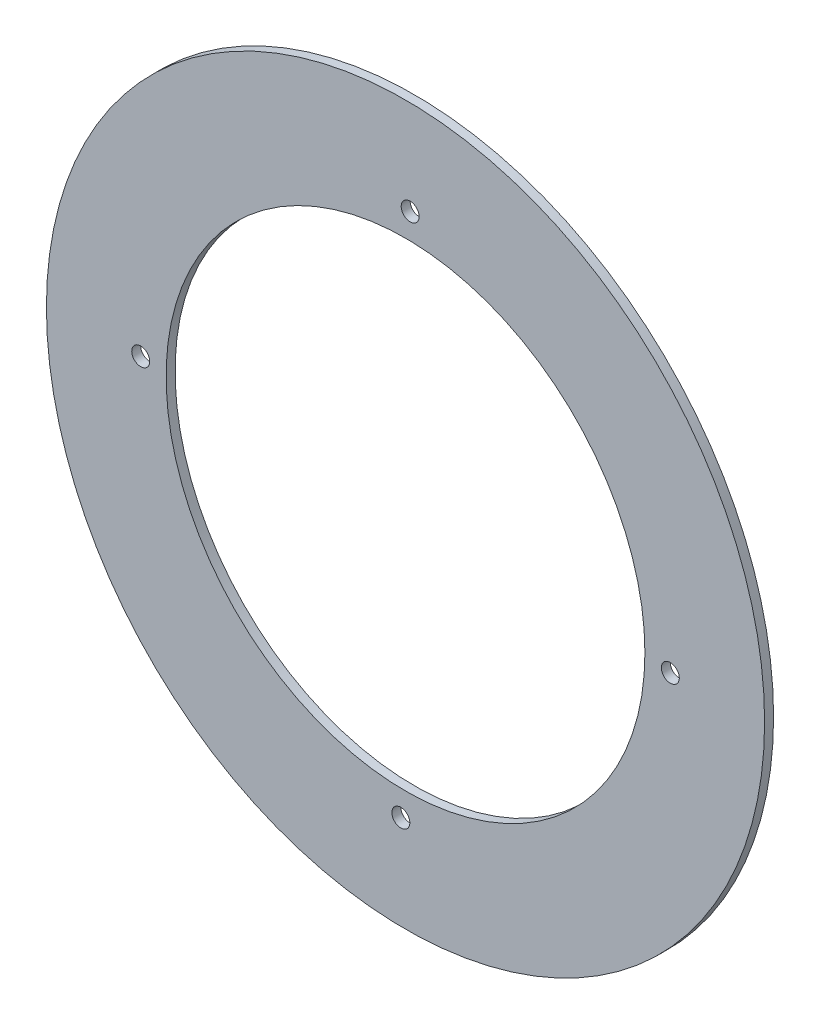
from build123d import *

# Parameters (mm, degrees)
SKETCH_1_R          = 60
SKETCH_1_R_2        = 40
EXTRUDE_1_DEPTH     = 1.5
SKETCH_2_R          = 1.5
CUT_EXTRUDE_2_DEPTH = 2


with BuildPart() as part:
    # 草图1 → 凸台-拉伸1 (new body)
    with BuildSketch(Plane.XY):
        Circle(SKETCH_1_R)
        Circle(SKETCH_1_R_2, mode=Mode.SUBTRACT)
    extrude(amount=EXTRUDE_1_DEPTH)

    # 草图2 → 切除-拉伸2 (cut)
    with BuildSketch(Plane(origin=(0, 0, 0), x_dir=(-1, 0, 0), z_dir=(0, 0, -1))):
        with Locations((-44.243136642, -0.779333123)):
            Circle(SKETCH_2_R)
        with Locations((-0.779333123, 44.243136642)):
            Circle(SKETCH_2_R)
        with Locations((44.243136642, 0.779333123)):
            Circle(SKETCH_2_R)
        with Locations((0.779333123, -44.243136642)):
            Circle(SKETCH_2_R)
    extrude(amount=-CUT_EXTRUDE_2_DEPTH, mode=Mode.SUBTRACT)


solid = part.part
